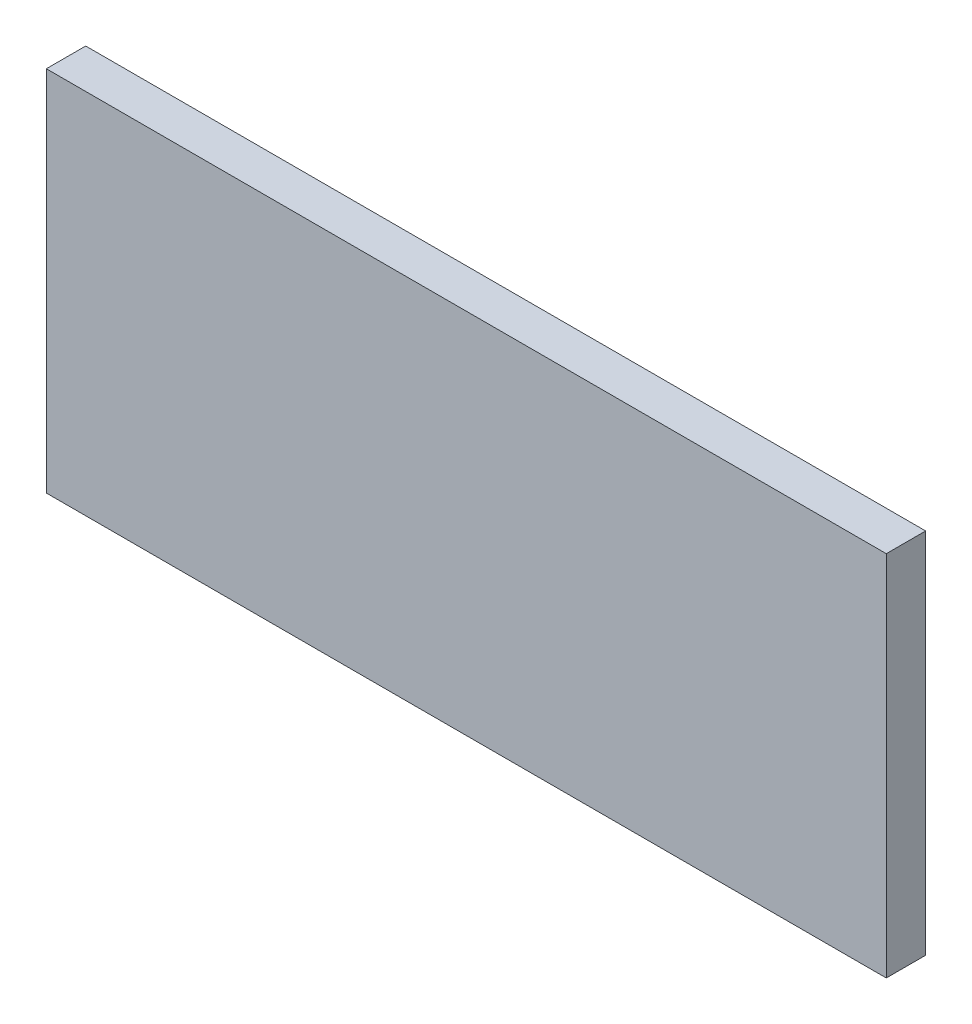
from build123d import *

# Parameters (mm, degrees)
ESBO_O1_W                = 320
ESBO_O1_H                = 140
RESSALTO_EXTRUS_O1_DEPTH = 15


with BuildPart() as part:
    # Esboço1 → Ressalto-extrusão1 (new body)
    with BuildSketch(Plane.XY):
        Rectangle(ESBO_O1_W, ESBO_O1_H)
    extrude(amount=RESSALTO_EXTRUS_O1_DEPTH)


solid = part.part
